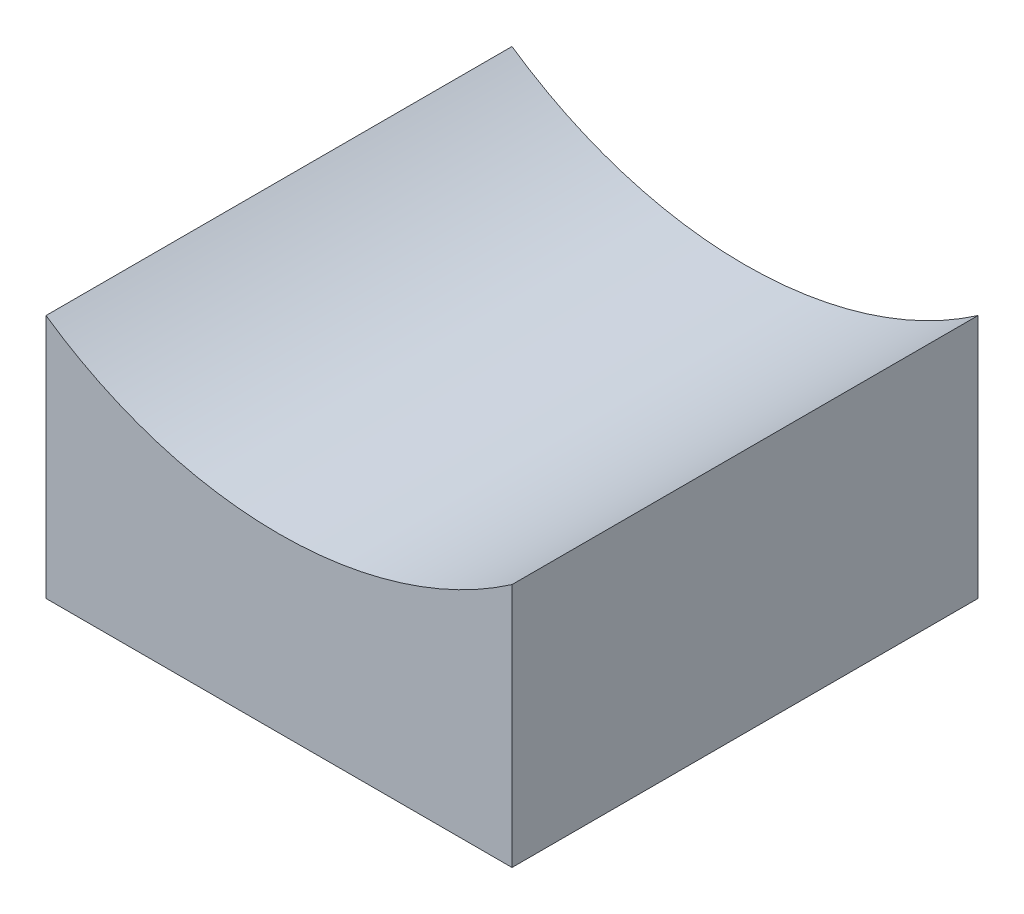
from build123d import *

# Parameters (mm, degrees)
BOSS_EXTRUDE1_DEPTH = 25.4


with BuildPart() as part:
    # Sketch1 → Boss-Extrude1 (new body)
    with BuildSketch(Plane.XY):
        with BuildLine():
            Line((12.7, 0), (-12.7, 0))
            Line((-12.7, 0), (-12.7, 13.356471138))
            ThreePointArc((-12.7, 13.356471138), (0, 9.398), (12.7, 13.356471138))
            Line((12.7, 13.356471138), (12.7, 0))
        make_face()
    extrude(amount=BOSS_EXTRUDE1_DEPTH)


solid = part.part
